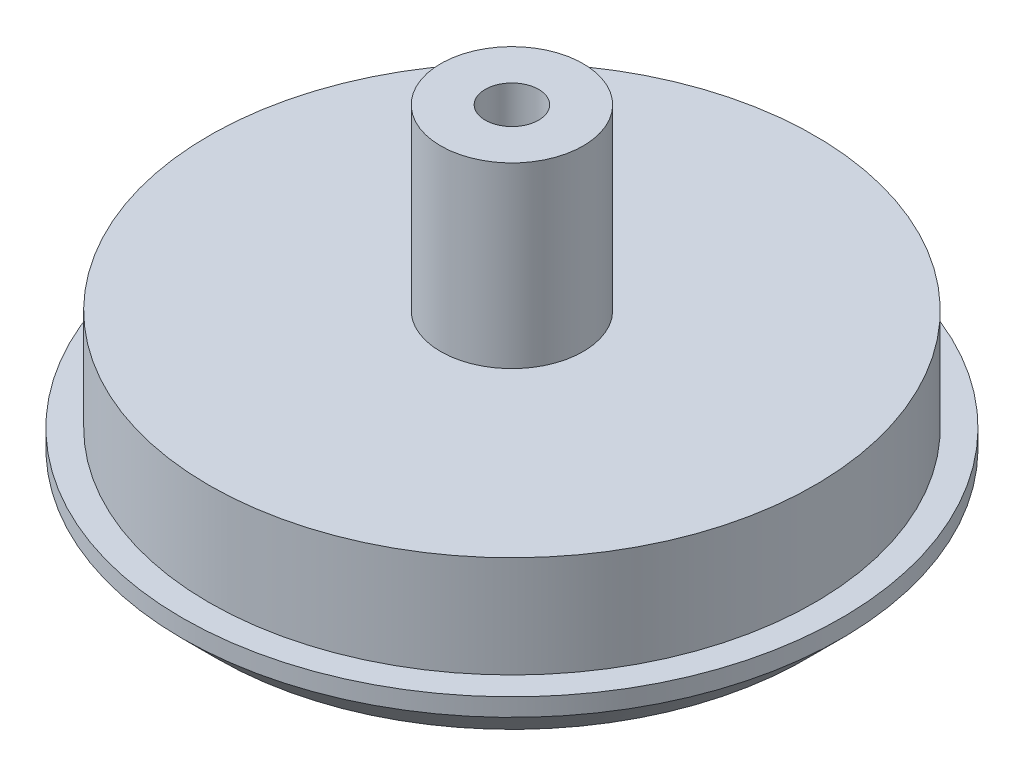
from build123d import *

# Parameters (mm, degrees)
SKETCH1_R           = 18.5
BOSS_EXTRUDE1_DEPTH = 8.7
CUT_EXTRUDE1_START  = -5.7
SKETCH2_R           = 18.5
SKETCH2_R_2         = 17
CUT_EXTRUDE1_DEPTH  = 5.7
SKETCH3_R           = 14.2
CUT_EXTRUDE2_DEPTH  = 5.6
SKETCH4_R           = 4
BOSS_EXTRUDE2_DEPTH = 10
CHAMFER1_SIZE       = 2
SKETCH5_R           = 1.5
CUT_EXTRUDE3_DEPTH  = 30.259357478


with BuildPart() as part:
    # Sketch1 → Boss-Extrude1 (new body)
    with BuildSketch(Plane(origin=(0, 0, 0), x_dir=(1, 0, 0), z_dir=(0, 1, 0))):
        with Locations(Location((0, 0, 0), (0, 0, 270))):
            Circle(SKETCH1_R)
    extrude(amount=BOSS_EXTRUDE1_DEPTH)

    # Sketch2 → Cut-Extrude1 (cut)
    with BuildSketch(Plane(origin=(0, 8.7, 0), x_dir=(1, 0, 0), z_dir=(0, 1, 0)).offset(CUT_EXTRUDE1_START)):
        with Locations(Location((0, 0, 0), (0, 0, 270))):
            Circle(SKETCH2_R)
        with Locations(Location((0, 0, 0), (0, 0, 270))):
            Circle(SKETCH2_R_2, mode=Mode.SUBTRACT)
    extrude(amount=CUT_EXTRUDE1_DEPTH, mode=Mode.SUBTRACT)

    # Sketch3 → Cut-Extrude2 (cut)
    with BuildSketch(Plane.XZ):
        with Locations(Location((0, 0, 0), (0, 0, 270))):
            Circle(SKETCH3_R)
    extrude(amount=-CUT_EXTRUDE2_DEPTH, mode=Mode.SUBTRACT)

    # Sketch4 → Boss-Extrude2 (add)
    with BuildSketch(Plane(origin=(0, 8.7, 0), x_dir=(1, 0, 0), z_dir=(0, 1, 0))):
        with Locations(Location((0, 0, 0), (0, 0, 270))):
            Circle(SKETCH4_R)
    extrude(amount=BOSS_EXTRUDE2_DEPTH)

    # Chamfer1
    chamfer1_edges = [part.edges().sort_by_distance(p)[0] for p in [
        (0, 0, -18.5),
    ]]
    chamfer(chamfer1_edges, length=CHAMFER1_SIZE)

    # Sketch5 → Cut-Extrude3 (cut, through all)
    with BuildSketch(Plane.XZ.offset(-5.6)):
        with Locations(Location((0, 0, 0), (0, 0, 270))):
            Circle(SKETCH5_R)
    extrude(amount=-CUT_EXTRUDE3_DEPTH, mode=Mode.SUBTRACT)


solid = part.part
